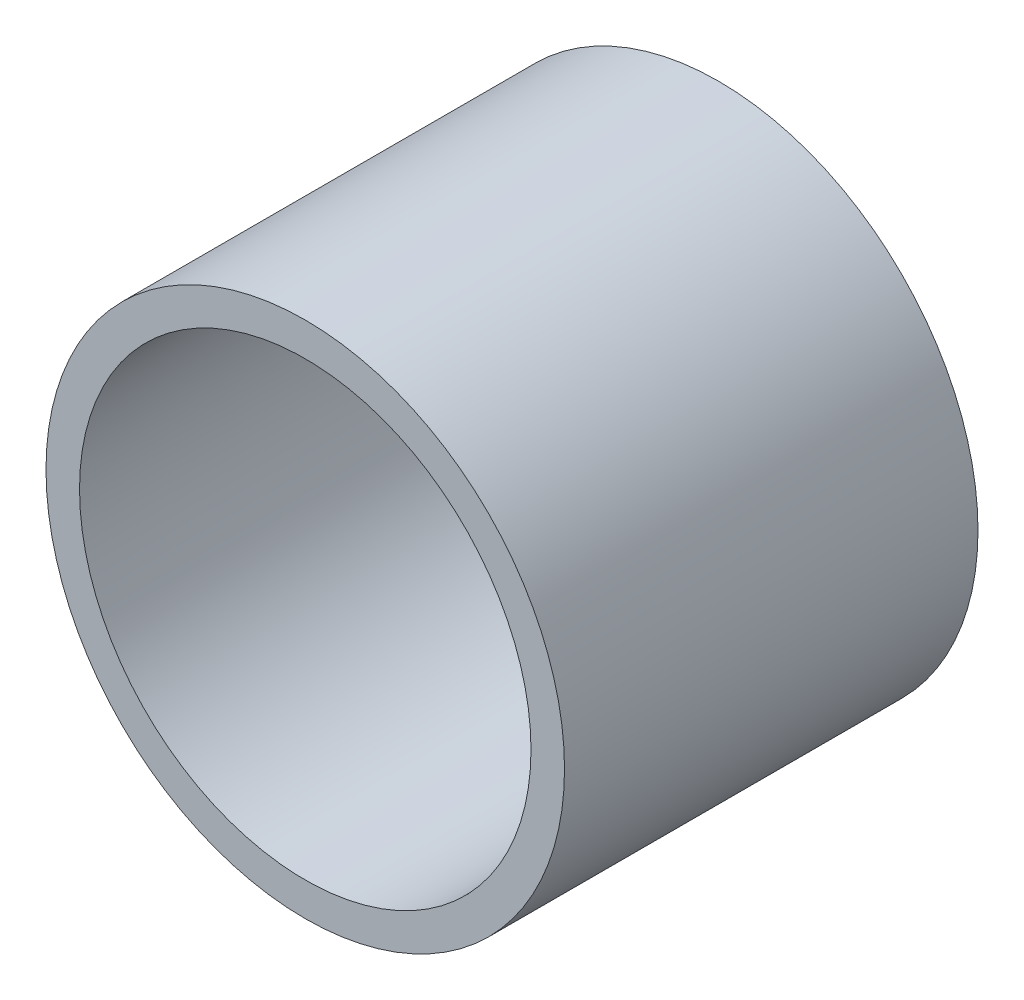
from build123d import *

# Parameters (mm, degrees)
CROQUIS1_R              = 11.6
CROQUIS1_R_2            = 10.1
SALIENTE_EXTRUIR1_DEPTH = 16
SALIENTE_EXTRUIR2_START = 2.5
CROQUIS2_R              = 11.6
SALIENTE_EXTRUIR2_DEPTH = 2.5
CROQUIS3_R              = 3.15
CORTAR_EXTRUIR1_DEPTH   = 2


with BuildPart() as part:
    # Croquis1 → Saliente-Extruir1 (new body)
    with BuildSketch(Plane.XY):
        Circle(CROQUIS1_R)
        Circle(CROQUIS1_R_2, mode=Mode.SUBTRACT)
    extrude(amount=SALIENTE_EXTRUIR1_DEPTH)

    # Croquis2 → Saliente-Extruir2 (add)
    with BuildSketch(Plane(origin=(0, 0, 0), x_dir=(-1, 0, 0), z_dir=(0, 0, -1)).offset(SALIENTE_EXTRUIR2_START)):
        Circle(CROQUIS2_R)
    extrude(amount=-SALIENTE_EXTRUIR2_DEPTH)

    # Croquis3 → Cortar-Extruir1 (cut)
    with BuildSketch(Plane(origin=(0, 0, -2.5), x_dir=(-1, 0, 0), z_dir=(0, 0, -1))):
        Circle(CROQUIS3_R)
    extrude(amount=-CORTAR_EXTRUIR1_DEPTH, mode=Mode.SUBTRACT)


solid = part.part
